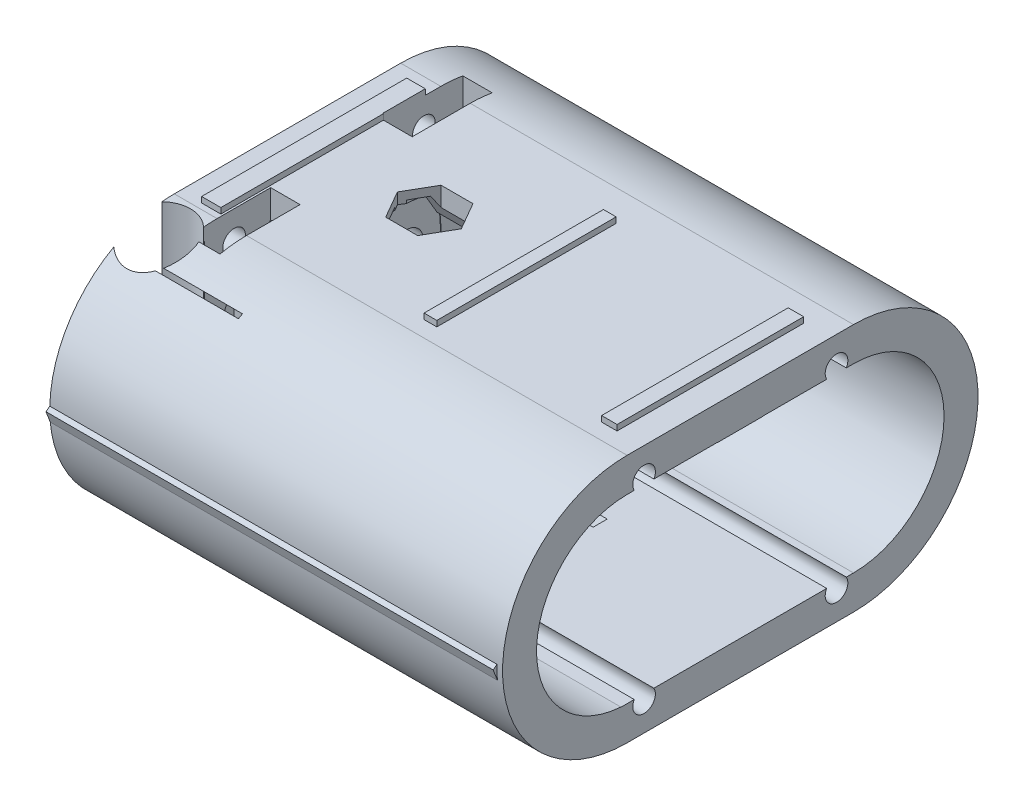
from build123d import *
from build123d.topology import SkipClean

# Parameters (mm, degrees)
SKETCH_1_R                = 3.722630253
SKETCH_1_R_2              = 1.5
EXTRUDE_1_DEPTH           = 5
EXTRUDE_2_DEPTH           = 35
SKETCH_6_R                = 1.5
CUT_EXTRUDE_1_DEPTH       = 35
CUT_EXTRUDE_2_DEPTH       = 15
EXTRUDE_4_DEPTH           = 20
SKETCH_9_R                = 4.80441392
CUT_EXTRUDE_3_DEPTH       = 10
EXTRUDE_START             = 5
SKETCH_10_R               = 1.5
SKETCH_10_R_2             = 4.80441392
EXTRUDE_5_DEPTH           = 5
SKETCH_15_R               = 2.804299678
CUT_EXTRUDE_9_DEPTH       = 25
SKETCH_16_W               = 4.234539201
SKETCH_16_H               = 12.191974049
CUT_EXTRUDE_10_DEPTH      = 25
SKETCH_17_W               = 4.234539201
SKETCH_17_H               = 4.727302919
CUT_EXTRUDE_11_DEPTH      = 11
SKETCH_18_W               = 26.444936371
SKETCH_18_H               = 8
CUT_EXTRUDE_12_DEPTH      = 6
SKETCH_19_W               = 20.553928747
SKETCH_19_H               = 15.980799643
CUT_EXTRUDE_13_DEPTH      = 56
CUT_EXTRUDE_15_DEPTH      = 53
CUT_EXTRUDE_15_DEPTH_BACK = 22
SKETCH_20_W               = 46.781434932
SKETCH_20_H               = 26.417751491
SKETCH_21_R               = 1.109271101
CUT_EXTRUDE_16_DEPTH      = 53
CUT_EXTRUDE_17_DEPTH      = 53
SKETCH_23_W               = 1.694860614
SKETCH_23_H               = 18.11669648
SKETCH_23_W_2             = 1.367091021
SKETCH_23_H_2             = 16.485509368
SKETCH_23_W_3             = 1.125839664
SKETCH_23_H_3             = 15.842172418
EXTRUDE_7_DEPTH           = 0.5
SKETCH_24_W               = 36.670206204
SKETCH_24_H               = 1.44750814
SKETCH_24_H_2             = 1.125839664
EXTRUDE_8_DEPTH           = 0.5
SKETCH_25_R               = 10.016960641
CUT_EXTRUDE_18_DEPTH      = 6.5
EXTRUDE_9_DEPTH           = 39.5
SKETCH_27_R               = 1
CUT_EXTRUDE_20_DEPTH      = 48
SKETCH_28_W               = 2.59519378
SKETCH_28_H               = 7.070337843
CUT_EXTRUDE_22_DEPTH      = 48


with BuildPart() as part:
    # ｽｹｯﾁ1 → ﾎﾞｽ - 押し出し1 (new body)
    with BuildSketch(Plane(origin=(0, 0, 0), x_dir=(0, 0, -1), z_dir=(1, 0, 0))):
        with BuildLine():
            Line((-6.640025947, 11), (-26.640025947, 11))
            ThreePointArc((-26.640025947, 11), (-37.640025947, 0), (-26.640025947, -11))
            Line((-26.640025947, -11), (-6.640025947, -11))
            ThreePointArc((-6.640025947, -11), (4.359974053, 0), (-6.640025947, 11))
        make_face()
        with Locations((-16.640025947, 0)):
            Circle(SKETCH_1_R, mode=Mode.SUBTRACT)
        with Locations((-23.640025947, 0)):
            Circle(SKETCH_1_R_2, mode=Mode.SUBTRACT)
        with Locations((-9.640025947, 0)):
            Circle(SKETCH_1_R_2, mode=Mode.SUBTRACT)
    extrude(amount=EXTRUDE_1_DEPTH)

    # ｽｹｯﾁ2 → ﾎﾞｽ - 押し出し2 (add)
    with BuildSketch(Plane(origin=(0, 0, 0), x_dir=(0, 0, -1), z_dir=(1, 0, 0))):
        with BuildLine():
            Line((-6.640025947, 11), (-26.640025947, 11))
            ThreePointArc((-26.640025947, 11), (-37.640025947, 0), (-26.640025947, -11))
            Line((-26.640025947, -11), (-6.640025947, -11))
            ThreePointArc((-6.640025947, -11), (4.359974053, 0), (-6.640025947, 11))
        make_face()
        with BuildLine():
            ThreePointArc((-26.640025947, -8), (-34.640025947, 0), (-26.640025947, 8))
            Line((-26.640025947, 8), (-6.640025947, 8))
            ThreePointArc((-6.640025947, 8), (1.359974053, 0), (-6.640025947, -8))
            Line((-6.640025947, -8), (-26.640025947, -8))
        make_face(mode=Mode.SUBTRACT)
    extrude(amount=EXTRUDE_2_DEPTH)

    # ｽｹｯﾁ6 → ｶｯﾄ - 押し出し1 (cut)
    with BuildSketch(Plane.ZY.offset(10)):
        with Locations((23.640025947, 0)):
            Circle(SKETCH_6_R)
        with Locations((16.640025947, -7)):
            Circle(SKETCH_6_R)
        with Locations((9.640025947, 0)):
            Circle(SKETCH_6_R)
        with Locations((16.640025947, 7)):
            Circle(SKETCH_6_R)
    extrude(amount=-CUT_EXTRUDE_1_DEPTH, mode=Mode.SUBTRACT)

    # ｽｹｯﾁ7 → ｶｯﾄ - 押し出し2 (cut)
    with BuildSketch(Plane(origin=(5, 0, 0), x_dir=(0, 0, -1), z_dir=(1, 0, 0))):
        Polygon((-18.555354676, -3.83674162), (-20.414736908, -7.121887566), (-18.499408179, -10.374732787), (-14.724697219, -10.342432062), (-12.865314987, -7.057286116), (-14.780643715, -3.804440895), align=None)
        Polygon((-18.555354676, 10.252845221), (-20.414736908, 6.967699275), (-18.499408179, 3.714854054), (-14.724697219, 3.747154779), (-12.865314987, 7.032300725), (-14.780643715, 10.285145946), align=None)
    extrude(amount=CUT_EXTRUDE_2_DEPTH, mode=Mode.SUBTRACT)

    # ｽｹｯﾁ8 → ﾎﾞｽ - 押し出し4 (add)
    with BuildSketch(Plane.XZ.offset(11)):
        Polygon((19.502706257, 18.640025947), (19.502706257, 14.640025947), (35, 14.640025947), (35, 16.640025947), (35, 18.640025947), align=None)
    extrude(amount=-EXTRUDE_4_DEPTH)

    # ｽｹｯﾁ9 → ｶｯﾄ - 押し出し3 (cut)
    with BuildSketch(Plane.ZY):
        with Locations((16.640025947, 0)):
            Circle(SKETCH_9_R)
    extrude(amount=-CUT_EXTRUDE_3_DEPTH, mode=Mode.SUBTRACT)

    # ｽｹｯﾁ10 → ﾎﾞｽ - 押し出し5 (add)
    with SkipClean():  # the faces are left unmerged after this step: merging them gives an invalid solid
        with BuildSketch(Plane.ZY.offset(EXTRUDE_START)):
            with BuildLine():
                Line((26.640025947, 12.5), (6.640025947, 12.5))
                ThreePointArc((6.640025947, 12.5), (-5.859974053, 0), (6.640025947, -12.5))
                Line((6.640025947, -12.5), (26.640025947, -12.5))
                ThreePointArc((26.640025947, -12.5), (39.140025947, 0), (26.640025947, 12.5))
            make_face()
            with Locations((16.640025947, -7)):
                Circle(SKETCH_10_R, mode=Mode.SUBTRACT)
            with Locations((9.640025947, 0)):
                Circle(SKETCH_10_R, mode=Mode.SUBTRACT)
            with Locations((16.640025947, 0)):
                Circle(SKETCH_10_R_2, mode=Mode.SUBTRACT)
            with Locations((23.640025947, 0)):
                Circle(SKETCH_10_R, mode=Mode.SUBTRACT)
            with Locations((16.640025947, 7)):
                Circle(SKETCH_10_R, mode=Mode.SUBTRACT)
        extrude(amount=-EXTRUDE_5_DEPTH)

    # ｽｹｯﾁ15 → ｶｯﾄ - 押し出し9 (cut)
    with SkipClean():  # the faces are left unmerged after this step: merging them gives an invalid solid
        with BuildSketch(Plane(origin=(0, 21, 0), x_dir=(1, 0, 0), z_dir=(0, 1, 0))):
            with Locations((-3.16117806, -29.862494133)):
                Circle(SKETCH_15_R)
        extrude(amount=-CUT_EXTRUDE_9_DEPTH, mode=Mode.SUBTRACT)

    # ｽｹｯﾁ16 → ｶｯﾄ - 押し出し10 (cut)
    with SkipClean():  # the faces are left unmerged after this step: merging them gives an invalid solid
        with BuildSketch(Plane.ZY.offset(5)):
            with Locations((29.862494133, 2.095987025)):
                Rectangle(SKETCH_16_W, SKETCH_16_H)
        extrude(amount=-CUT_EXTRUDE_10_DEPTH, mode=Mode.SUBTRACT)

    # ｽｹｯﾁ17 → ｶｯﾄ - 押し出し11 (cut)
    with SkipClean():  # the faces are left unmerged after this step: merging them gives an invalid solid
        with BuildSketch(Plane.ZY.offset(5)):
            with Locations((29.862494133, 7.447893014)):
                Rectangle(SKETCH_17_W, SKETCH_17_H)
        extrude(amount=-CUT_EXTRUDE_11_DEPTH, mode=Mode.SUBTRACT)

    # ｽｹｯﾁ18 → ｶｯﾄ - 押し出し12 (cut)
    with BuildSketch(Plane(origin=(5, 0, 0), x_dir=(0, 0, -1), z_dir=(1, 0, 0))):
        with Locations((-16.640025947, 0)):
            Rectangle(SKETCH_18_W, SKETCH_18_H)
    extrude(amount=-CUT_EXTRUDE_12_DEPTH, mode=Mode.SUBTRACT)

    # ｽｹｯﾁ19 → ｶｯﾄ - 押し出し13 (cut)
    with BuildSketch(Plane(origin=(5, 0, 0), x_dir=(0, 0, -1), z_dir=(1, 0, 0))):
        with Locations((-16.916990321, -0.009600178)):
            Rectangle(SKETCH_19_W, SKETCH_19_H)
    extrude(amount=CUT_EXTRUDE_13_DEPTH, mode=Mode.SUBTRACT)

    # ｽｹｯﾁ20 → ｶｯﾄ - 押し出し15 (cut, two sides: drawn at the far end of the back side and taken through both)
    with SkipClean():  # the faces are left unmerged after this step: merging them gives an invalid solid
        with BuildSketch(Plane(origin=(-1, 0, 0), x_dir=(0, 0, -1), z_dir=(1, 0, 0)).offset(-CUT_EXTRUDE_15_DEPTH_BACK)):
            with Locations((-16.631849884, -0.276988926)):
                Rectangle(SKETCH_20_W, SKETCH_20_H)
            with BuildLine():
                Line((-26.640025947, 11), (-6.640025947, 11))
                ThreePointArc((-6.640025947, 11), (4.359974053, 0), (-6.640025947, -11))
                Line((-6.640025947, -11), (-26.640025947, -11))
                ThreePointArc((-26.640025947, -11), (-37.640025947, 0), (-26.640025947, 11))
            make_face(mode=Mode.SUBTRACT)
        extrude(amount=CUT_EXTRUDE_15_DEPTH + CUT_EXTRUDE_15_DEPTH_BACK, mode=Mode.SUBTRACT)

    # ｽｹｯﾁ21 → ｶｯﾄ - 押し出し16 (cut)
    with SkipClean():  # the faces are left unmerged after this step: merging them gives an invalid solid
        with BuildSketch(Plane.ZY.offset(5)):
            with Locations((21.637222187, 4.99719624)):
                Circle(SKETCH_21_R)
            with Locations((21.637222187, -4.99719624)):
                Circle(SKETCH_21_R)
            with Locations((11.642829707, -4.99719624)):
                Circle(SKETCH_21_R)
            with Locations((11.642829707, 4.99719624)):
                Circle(SKETCH_21_R)
            Polygon((11.642829707, 2.730644966), (11.140025947, 1.5), (21.637222187, -3.283512956), (22.449958954, -1.5), (11.952762714, 3.283512956), align=None)
        extrude(amount=-CUT_EXTRUDE_16_DEPTH, mode=Mode.SUBTRACT)

    # ｽｹｯﾁ22 → ｶｯﾄ - 押し出し17 (cut)
    with SkipClean():  # the faces are left unmerged after this step: merging them gives an invalid solid
        with BuildSketch(Plane(origin=(0, 11, 0), x_dir=(1, 0, 0), z_dir=(0, 1, 0))):
            Polygon((8.940313814, -19.08350705), (10.351058286, -16.640025947), (8.940313814, -14.196544844), (6.118824868, -14.196544844), (4.708080396, -16.640025947), (6.118824868, -19.08350705), align=None)
        extrude(amount=-CUT_EXTRUDE_17_DEPTH, mode=Mode.SUBTRACT)

    # ｽｹｯﾁ23 → ﾎﾞｽ - 押し出し7 (add)
    with SkipClean():  # the faces are left unmerged after this step: merging them gives an invalid solid
        with BuildSketch(Plane(origin=(0, 11, 0), x_dir=(1, 0, 0), z_dir=(0, 1, 0))):
            with Locations((-2.245669245, -17.073234553)):
                Rectangle(SKETCH_23_W, SKETCH_23_H)
            with Locations((32.015073953, -16.982584293)):
                Rectangle(SKETCH_23_W_2, SKETCH_23_H_2)
            with Locations((16.213110095, -17.304252768)):
                Rectangle(SKETCH_23_W_3, SKETCH_23_H_3)
        extrude(amount=EXTRUDE_7_DEPTH)

    # ｽｹｯﾁ24 → ﾎﾞｽ - 押し出し8 (add)
    with SkipClean():  # the faces are left unmerged after this step: merging them gives an invalid solid
        with BuildSketch(Plane(origin=(0, -11, 0), x_dir=(-1, 0, 0), z_dir=(0, -1, 0))):
            with Locations((-15.167534632, -23.824922695)):
                Rectangle(SKETCH_24_W, SKETCH_24_H)
            with Locations((-15.167534632, -9.26942418)):
                Rectangle(SKETCH_24_W, SKETCH_24_H_2)
        extrude(amount=EXTRUDE_8_DEPTH)

    # ｽｹｯﾁ25 → ｶｯﾄ - 押し出し18 (cut)
    with SkipClean():  # the faces are left unmerged after this step: merging them gives an invalid solid
        with BuildSketch(Plane(origin=(5, 0, 0), x_dir=(0, 0, -1), z_dir=(1, 0, 0))):
            with Locations((-16.640025947, 0)):
                Circle(SKETCH_25_R)
        extrude(amount=-CUT_EXTRUDE_18_DEPTH, mode=Mode.SUBTRACT)

    # ｽｹｯﾁ26 → ﾎﾞｽ - 押し出し9 (add)
    with SkipClean():  # the faces are left unmerged after this step: merging them gives an invalid solid
        with BuildSketch(Plane.ZY.offset(5)):
            Polygon((-4.858082772, 0), (-4.315799689, -0.984827209), (-4.309056641, 0.753573013), align=None)
            Polygon((37.973401563, 0), (37.595851583, -0.984827209), (37.528535533, 0.34167874), align=None)
        extrude(amount=-EXTRUDE_9_DEPTH)

    # ｽｹｯﾁ27 → ｶｯﾄ - 押し出し20 (cut)
    with SkipClean():  # the faces are left unmerged after this step: merging them gives an invalid solid
        with BuildSketch(Plane.ZY.offset(5)):
            with Locations((8.140025947, 8.5)):
                Circle(SKETCH_27_R)
            with Locations((8.140025947, -8.5)):
                Circle(SKETCH_27_R)
            with Locations((25.140025947, 8.5)):
                Circle(SKETCH_27_R)
            with Locations((25.140025947, -8.5)):
                Circle(SKETCH_27_R)
        extrude(amount=-CUT_EXTRUDE_20_DEPTH, mode=Mode.SUBTRACT)

    # ｽｹｯﾁ28 → ｶｯﾄ - 押し出し22 (cut)
    with SkipClean():  # the faces are left unmerged after this step: merging them gives an invalid solid
        with BuildSketch(Plane(origin=(0, 11.5, 0), x_dir=(1, 0, 0), z_dir=(0, 1, 0))):
            with Locations((-0.156539999, -8.229639898)):
                Rectangle(SKETCH_28_W, SKETCH_28_H)
            with Locations((0.078445114, -25.441108734)):
                Rectangle(SKETCH_28_W, SKETCH_28_H)
        extrude(amount=-CUT_EXTRUDE_22_DEPTH, mode=Mode.SUBTRACT)


solid = part.part
